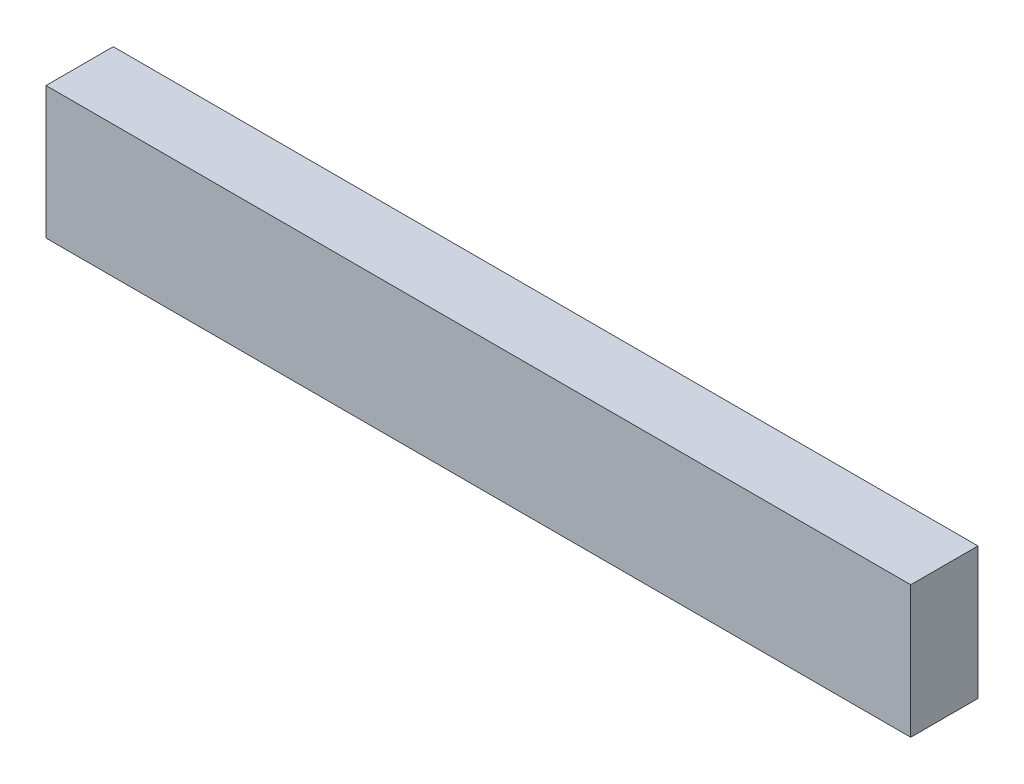
from build123d import *

# Parameters (mm, degrees)
SKETCH_1_W      = 360
SKETCH_1_H      = 55
EXTRUDE_1_DEPTH = 28


with BuildPart() as part:
    # 草图1 → 凸台-拉伸1 (new body)
    with BuildSketch(Plane.XY):
        Rectangle(SKETCH_1_W, SKETCH_1_H)
    extrude(amount=EXTRUDE_1_DEPTH)


solid = part.part
